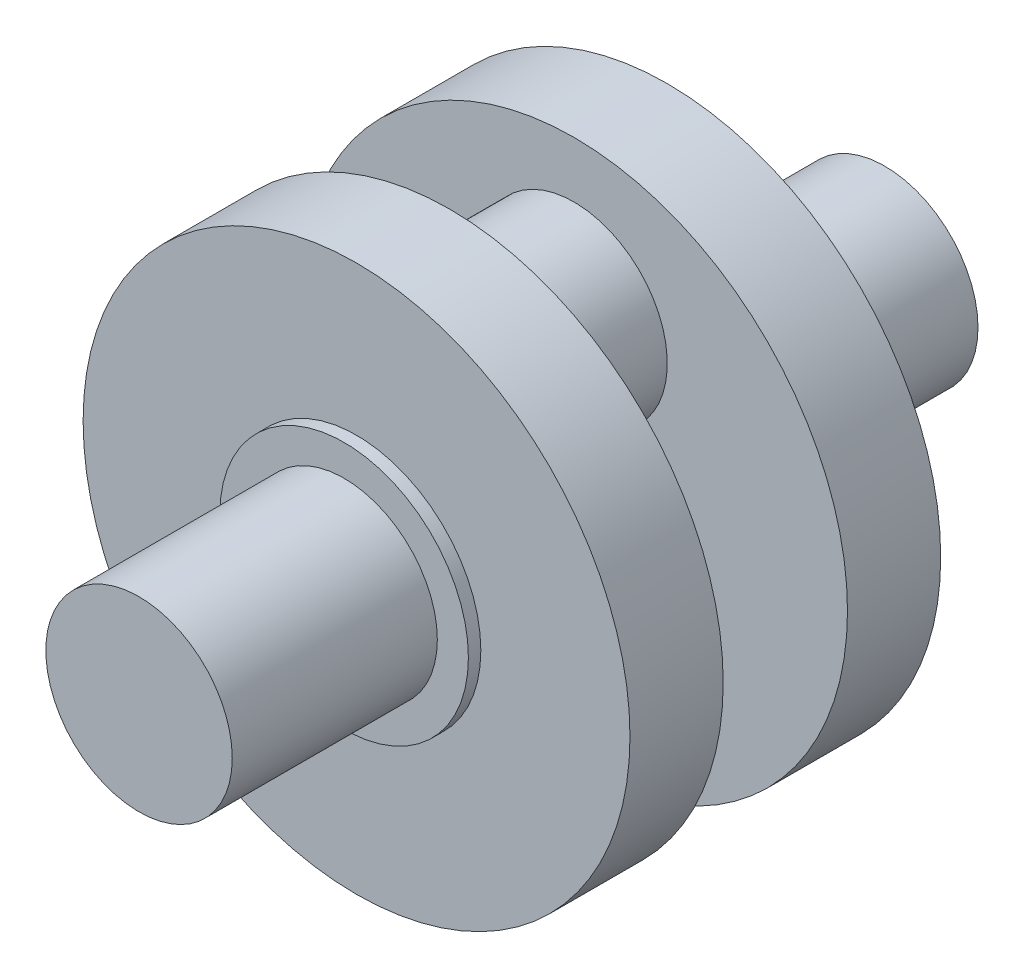
from build123d import *

# Parameters (mm, degrees)
SZKIC1_R                    = 15
DODANIE_WYCI_GNI_CIE1_DEPTH = 33
SZKIC3_R                    = 20
DODANIE_WYCI_GNI_CIE3_DEPTH = 2
SZKIC5_R                    = 44
DODANIE_WYCI_GNI_CIE4_DEPTH = 15
SZKIC6_R                    = 15
DODANIE_WYCI_GNI_CIE5_DEPTH = 10


with BuildPart() as part:
    # Szkic1 → Dodanie-wyciągnięcie1 (new body)
    with BuildSketch(Plane.XY):
        Circle(SZKIC1_R)
    extrude(amount=DODANIE_WYCI_GNI_CIE1_DEPTH)

    # Szkic3 → Dodanie-wyciągnięcie3 (add)
    with BuildSketch(Plane(origin=(0, 0, 0), x_dir=(-1, 0, 0), z_dir=(0, 0, -1))):
        Circle(SZKIC3_R)
    extrude(amount=DODANIE_WYCI_GNI_CIE3_DEPTH)

    # Szkic5 → Dodanie-wyciągnięcie4 (add)
    with BuildSketch(Plane(origin=(0, 0, -2), x_dir=(-1, 0, 0), z_dir=(0, 0, -1))):
        Circle(SZKIC5_R)
    extrude(amount=DODANIE_WYCI_GNI_CIE4_DEPTH)

    # Szkic6 → Dodanie-wyciągnięcie5 (add)
    with BuildSketch(Plane(origin=(0, 0, -17), x_dir=(-1, 0, 0), z_dir=(0, 0, -1))):
        with Locations((0, 20)):
            Circle(SZKIC6_R)
    extrude(amount=DODANIE_WYCI_GNI_CIE5_DEPTH)

    # Lustro5: part across plane


with BuildPart() as part_1:
    add(part.part)
    add(part.part.mirror(Plane(origin=(0, 20, -27), x_dir=(1, 0, 0), z_dir=(0, 0, -1))))


solid = part_1.part
